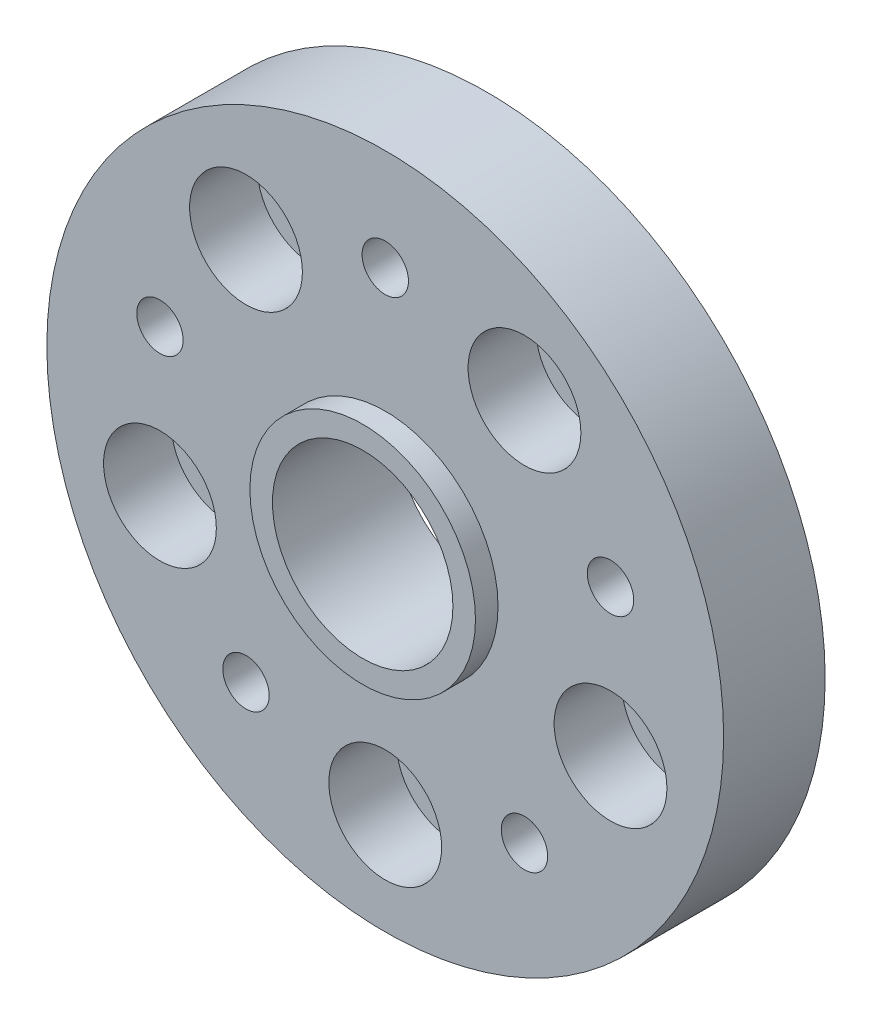
from build123d import *

# Parameters (mm, degrees)
SKETCH1_R                                        = 47.625
BOSS_EXTRUDE1_DEPTH                              = 14.2875
SKETCH2_R                                        = 12.7
CUT_EXTRUDE1_DEPTH                               = 69.850663804
BOSS_EXTRUDE2_START                              = 3.175
SKETCH3_R                                        = 15.875
SKETCH3_R_2                                      = 12.7
BOSS_EXTRUDE2_DEPTH                              = 3.175
CBORE_FOR_3_8_SOCKET_HEAD_CAP_SCREW1_D           = 10.0838
CBORE_FOR_3_8_SOCKET_HEAD_CAP_SCREW1_CBORE_D     = 15.875
CBORE_FOR_3_8_SOCKET_HEAD_CAP_SCREW1_CBORE_DEPTH = 9.525
F_5_16_18_TAPPED_HOLE1_D                         = 6.5278


with BuildPart() as part:
    # Sketch1 → Boss-Extrude1 (new body)
    with BuildSketch(Plane.XY):
        Circle(SKETCH1_R)
    extrude(amount=BOSS_EXTRUDE1_DEPTH)

    # Sketch2 → Cut-Extrude1 (cut, through all)
    with BuildSketch(Plane.XY.offset(14.2875)):
        Circle(SKETCH2_R)
    extrude(amount=-CUT_EXTRUDE1_DEPTH, mode=Mode.SUBTRACT)

    # Sketch3 → Boss-Extrude2 (add)
    with BuildSketch(Plane.XY.offset(14.2875).offset(BOSS_EXTRUDE2_START)):
        Circle(SKETCH3_R)
        Circle(SKETCH3_R_2, mode=Mode.SUBTRACT)
    extrude(amount=-BOSS_EXTRUDE2_DEPTH)

    # CBORE for 3/8 Socket Head Cap Screw1 (through all)
    with Locations(Plane.XY.offset(14.2875)):
        with Locations((0, -33.3375), (-31.705846612, -10.30185405), (-19.595290848, 26.97060405), (19.595290848, 26.97060405), (31.705846612, -10.30185405), (0, 0)):
            CounterBoreHole(CBORE_FOR_3_8_SOCKET_HEAD_CAP_SCREW1_D / 2, CBORE_FOR_3_8_SOCKET_HEAD_CAP_SCREW1_CBORE_D / 2, CBORE_FOR_3_8_SOCKET_HEAD_CAP_SCREW1_CBORE_DEPTH)

    # 5/16-18 Tapped Hole1 (through all)
    with Locations(Plane.XY.offset(14.2875)):
        with Locations((-19.595290848, -26.97060405), (-31.705846612, 10.30185405), (0, 33.3375), (31.705846612, 10.30185405), (19.595290848, -26.97060405), (0, 0)):
            Hole(F_5_16_18_TAPPED_HOLE1_D / 2)


solid = part.part
